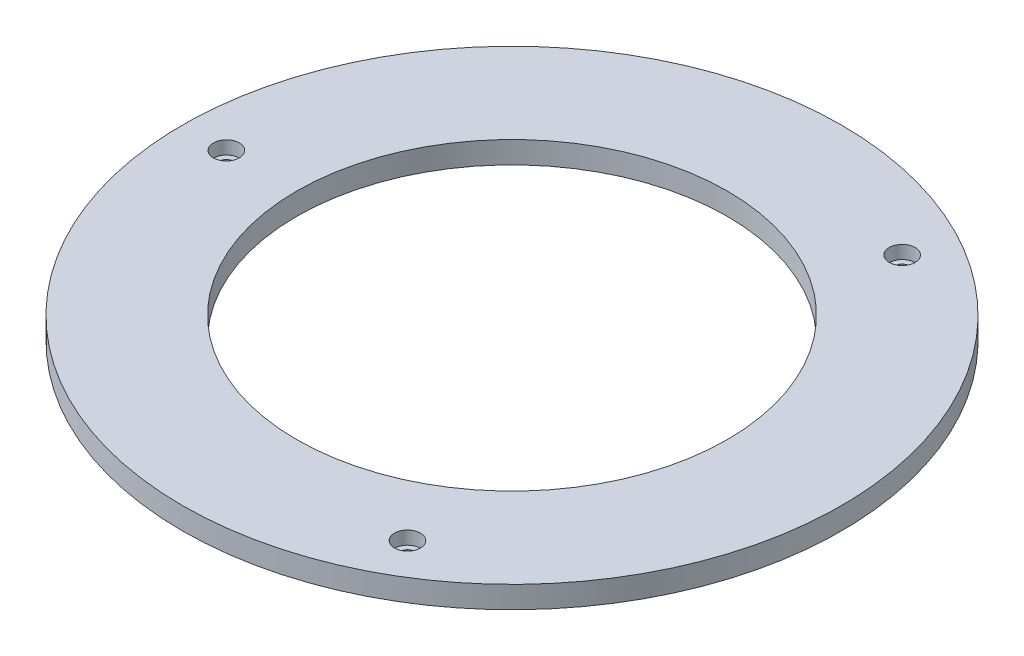
from build123d import *

# Parameters (mm, degrees)
CROQUIS1_R              = 75
CROQUIS1_R_2            = 49
SALIENTE_EXTRUIR1_DEPTH = 5
CROQUIS2_R              = 1.7
CORTAR_EXTRUIR1_DEPTH   = 5
CROQUIS3_R              = 2.95
CORTAR_EXTRUIR2_DEPTH   = 3
MATRIZC1_COUNT          = 3


with BuildPart() as part:
    # Croquis1 → Saliente-Extruir1 (new body)
    with BuildSketch(Plane(origin=(0, 0, 0), x_dir=(1, 0, 0), z_dir=(0, 1, 0))):
        with Locations(Location((0, 0, 0), (0, 0, 270))):
            Circle(CROQUIS1_R)
        with Locations(Location((0, 0, 0), (0, 0, 270))):
            Circle(CROQUIS1_R_2, mode=Mode.SUBTRACT)
    extrude(amount=SALIENTE_EXTRUIR1_DEPTH)

    # Croquis2 → Cortar-Extruir1 (cut)
    with BuildSketch(Plane(origin=(0, 5, 0), x_dir=(1, 0, 0), z_dir=(0, 1, 0))):
        with Locations(Location((-65, 0, 0), (0, 0, 270))):
            Circle(CROQUIS2_R)
    cortar_extruir1 = extrude(amount=-CORTAR_EXTRUIR1_DEPTH, mode=Mode.SUBTRACT)

    # Croquis3 → Cortar-Extruir2 (cut)
    with BuildSketch(Plane(origin=(0, 5, 0), x_dir=(1, 0, 0), z_dir=(0, 1, 0))):
        with Locations(Location((-65, 0, 0), (0, 0, 270))):
            Circle(CROQUIS3_R)
    cortar_extruir2 = extrude(amount=-CORTAR_EXTRUIR2_DEPTH, mode=Mode.SUBTRACT)

    # MatrizC1: Cortar-Extruir1, Cortar-Extruir2 ×3 about axis
    matrizc1_axis = Axis((0, 0, 0), (0, 1, 0))
    add([cortar_extruir1.rotate(matrizc1_axis, i * 360 / MATRIZC1_COUNT) for i in range(1, MATRIZC1_COUNT)], mode=Mode.SUBTRACT)
    add([cortar_extruir2.rotate(matrizc1_axis, i * 360 / MATRIZC1_COUNT) for i in range(1, MATRIZC1_COUNT)], mode=Mode.SUBTRACT)


solid = part.part
